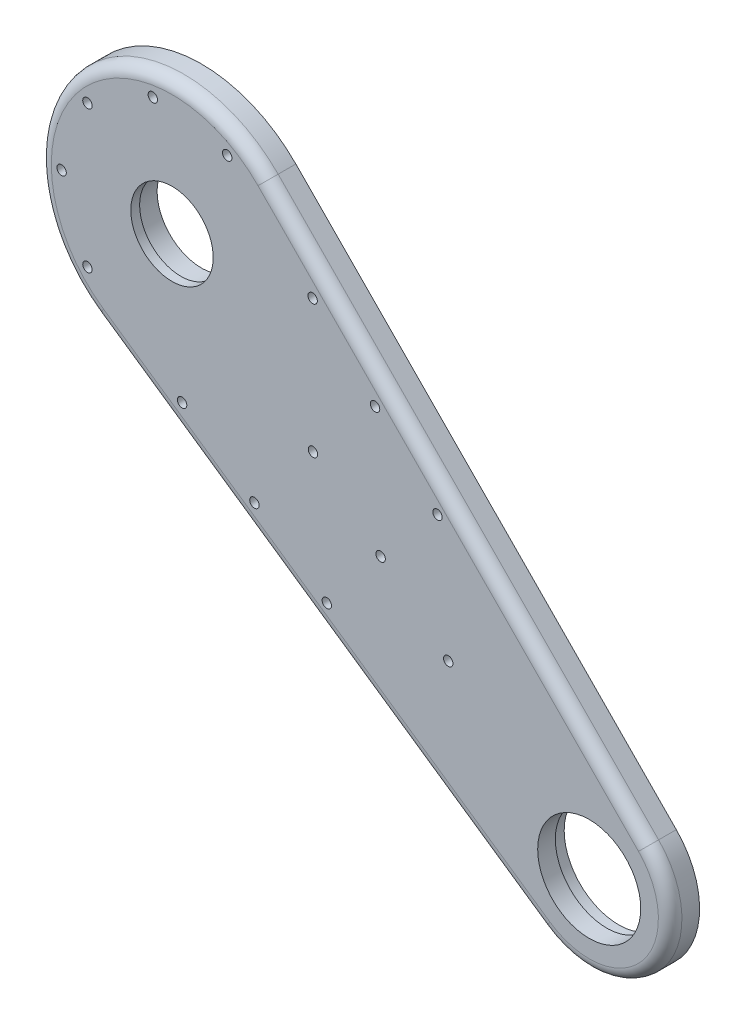
from build123d import *

# Parameters (mm, degrees)
SKETCH1_R           = 17.5
SKETCH1_R_2         = 1.6
BOSS_EXTRUDE1_DEPTH = 10
SKETCH2_R           = 18.5
CUT_EXTRUDE1_DEPTH  = 4
SKETCH3_R           = 1.6
CUT_EXTRUDE2_DEPTH  = 224.991888552
SKETCH4_R           = 14
CUT_EXTRUDE3_DEPTH  = 224.991888552
SKETCH4_3_R         = 15.0625
SKETCH4_3_R_2       = 14
CUT_EXTRUDE4_DEPTH  = 7
FILLET1_R           = 4


with BuildPart() as part:
    # Sketch1 → Boss-Extrude1 (new body)
    with BuildSketch(Plane.XY.offset(37)):
        with BuildLine():
            Line((-25.534872354, -37.053613776), (126.113577761, -141.559582877))
            ThreePointArc((126.113577761, -141.559582877), (162.784444163, -136.592367058), (161.308367688, -99.616065541))
            Line((161.308367688, -99.616065541), (32.056602073, 31.581232775))
            ThreePointArc((32.056602073, 31.581232775), (-34.47199994, 28.925442436), (-25.534872354, -37.053613776))
        make_face()
        with Locations((141.718221977, -118.915707792)):
            Circle(SKETCH1_R, mode=Mode.SUBTRACT)
        with Locations((70.859110989, -59.457853896)):
            Circle(SKETCH1_R_2, mode=Mode.SUBTRACT)
        with Locations((93.840444282, -78.741482187)):
            Circle(SKETCH1_R_2, mode=Mode.SUBTRACT)
        with Locations((47.877777695, -40.174225605)):
            Circle(SKETCH1_R_2, mode=Mode.SUBTRACT)
        with Locations((47.767990244, 4.946625931)):
            Circle(SKETCH1_R_2, mode=Mode.SUBTRACT)
        with Locations((3.423348889, -47.901259716)):
            Circle(SKETCH1_R_2, mode=Mode.SUBTRACT)
        with Locations((68.973861607, -16.273907044)):
            Circle(SKETCH1_R_2, mode=Mode.SUBTRACT)
        with Locations((90.17973297, -37.494440018)):
            Circle(SKETCH1_R_2, mode=Mode.SUBTRACT)
        with Locations((28.003855203, -65.100059364)):
            Circle(SKETCH1_R_2, mode=Mode.SUBTRACT)
        with Locations((52.584361518, -82.298859012)):
            Circle(SKETCH1_R_2, mode=Mode.SUBTRACT)
    extrude(amount=BOSS_EXTRUDE1_DEPTH)

    # Sketch2 → Cut-Extrude1 (cut)
    with BuildSketch(Plane(origin=(0, 0, 37), x_dir=(-1, 0, 0), z_dir=(0, 0, -1))):
        with Locations((-141.718221977, -118.915707792)):
            Circle(SKETCH2_R)
    extrude(amount=-CUT_EXTRUDE1_DEPTH, mode=Mode.SUBTRACT)

    # Sketch3 → Cut-Extrude2 (cut, through all)
    with BuildSketch(Plane(origin=(0, 0, 37), x_dir=(-1, 0, 0), z_dir=(0, 0, -1))):
        with Locations((-18.75, 32.475952642)):
            Circle(SKETCH3_R)
        with Locations((6.511806663, 36.930290738)):
            Circle(SKETCH3_R)
        with Locations((28.726666617, 24.104535363)):
            Circle(SKETCH3_R)
        with Locations((37.5, 0)):
            Circle(SKETCH3_R)
        with Locations((28.726666617, -24.104535363)):
            Circle(SKETCH3_R)
    extrude(amount=-CUT_EXTRUDE2_DEPTH, mode=Mode.SUBTRACT)

    # Sketch4 → Cut-Extrude3 (cut, through all)
    with BuildSketch(Plane(origin=(0, 0, 37), x_dir=(-1, 0, 0), z_dir=(0, 0, -1))):
        Circle(SKETCH4_R)
    extrude(amount=-CUT_EXTRUDE3_DEPTH, mode=Mode.SUBTRACT)

    # Sketch4<3> → Cut-Extrude4 (cut)
    with BuildSketch(Plane(origin=(0, 0, 37), x_dir=(-1, 0, 0), z_dir=(0, 0, -1))):
        Circle(SKETCH4_3_R)
        Circle(SKETCH4_3_R_2, mode=Mode.SUBTRACT)
    extrude(amount=-CUT_EXTRUDE4_DEPTH, mode=Mode.SUBTRACT)

    # Fillet1
    fillet1_edges = [part.edges().sort_by_distance(p)[0] for p in [
        (162.784444163, -136.592367058, 47),
        (96.68248488, -34.017416383, 47),
        (-34.47199994, 28.925442436, 47),
        (50.289352703, -89.306598327, 47),
    ]]
    fillet(fillet1_edges, radius=FILLET1_R)


solid = part.part
